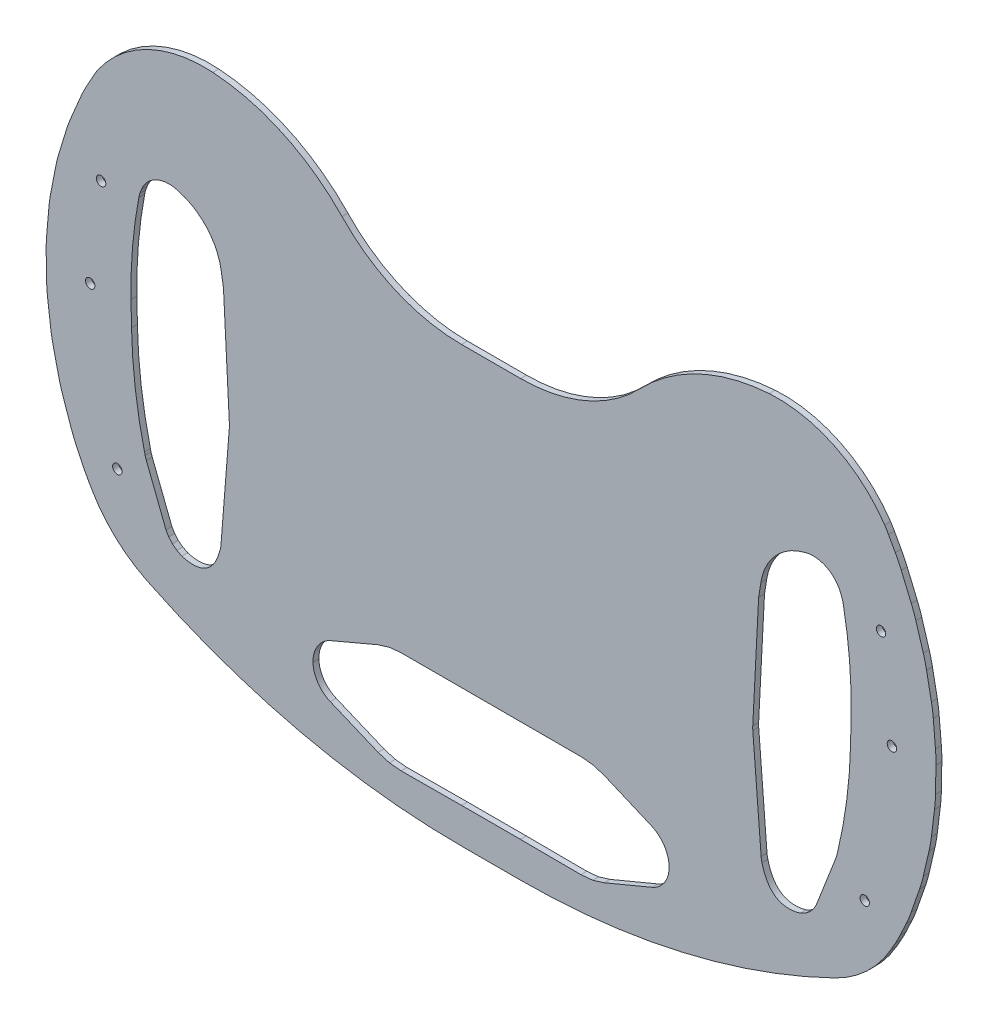
from build123d import *

# Parameters (mm, degrees)
SKETCH1_R           = 1.600004733
SKETCH1_R_2         = 1.600008458
SKETCH1_R_3         = 1.600001007
BOSS_EXTRUDE1_DEPTH = 2


with BuildPart() as part:
    # Sketch1 → Boss-Extrude1 (new body)
    with BuildSketch(Plane(origin=(0, 0, 3.49999997), x_dir=(-1, 0, 0), z_dir=(0, 0, -1))):
        with BuildLine():
            Line((-20, -102.64135196), (0, -102.64135196))
            ThreePointArc((0, -102.64135196), (54.826762958, -96.402803145), (106.850367414, -78.006118468))
            ThreePointArc((106.850367414, -78.006118468), (117.721514816, -70.507303457), (125.877694674, -60.120253705))
            Line((125.877694674, -60.120253705), (127.430048958, -57.377443185))
            ThreePointArc((127.430048958, -57.377443185), (128.246970558, -55.865942841), (129.004258673, -54.323701322))
            Line((129.004258673, -54.323701322), (131.011852014, -50.025012538))
            ThreePointArc((131.011852014, -50.025012538), (131.934514731, -47.905941493), (132.744632644, -45.741345098))
            Line((132.744632644, -45.741345098), (135.592695073, -37.476432501))
            ThreePointArc((135.592695073, -37.476432501), (136.284091675, -35.286016159), (136.86023823, -33.062503586))
            Line((136.86023823, -33.062503586), (138.815821901, -24.612835894))
            ThreePointArc((138.815821901, -24.612835894), (139.275226116, -22.361847038), (139.61651234, -20.089947662))
            Line((139.61651234, -20.089947662), (140.680309789, -11.484569813))
            ThreePointArc((140.680309789, -11.484569813), (140.902861597, -9.193521368), (141.005295113, -6.893969312))
            Line((141.005295113, -6.893969312), (141.164836348, 1.796846962))
            ThreePointArc((141.164836348, 1.796846962), (141.146870605, 4.098627751), (141.008553463, 6.396319188))
            Line((141.008553463, 6.396319188), (140.259460965, 15.056256593))
            ThreePointArc((140.259460965, 15.056256593), (140.001172695, 17.343557944), (139.62361976, 19.614221742))
            Line((139.62361976, 19.614221742), (137.974097204, 28.14852801))
            ThreePointArc((137.974097204, 28.14852801), (137.478304699, 30.396372901), (136.865634255, 32.61521309))
            Line((136.865634255, 32.61521309), (134.347453197, 40.885413673))
            ThreePointArc((134.347453197, 40.885413673), (133.622933873, 43.059929206), (132.786161536, 45.193765683))
            Line((132.786161536, 45.193765683), (129.38103378, 53.252929979))
            ThreePointArc((129.38103378, 53.252929979), (128.425728272, 55.357904754), (127.361191228, 57.40980346))
            Line((127.361191228, 57.40980346), (125.064933981, 61.565045915))
            ThreePointArc((125.064933981, 61.565045915), (124.417848961, 62.6960994), (123.737554881, 63.807495357))
            ThreePointArc((123.737554881, 63.807495357), (106.650553606, 78.494623558), (84.533580324, 82.797743379))
            ThreePointArc((84.533580324, 82.797743379), (60.673509561, 76.661567164), (40.645738515, 62.314301841))
            ThreePointArc((40.645738515, 62.314301841), (22.112560671, 49.500314192), (0.037401719, 44.987630099))
            Line((0.037401719, 44.987630099), (-20.037401719, 44.987630099))
            ThreePointArc((-20.037401719, 44.987630099), (-42.112560671, 49.500314192), (-60.645738515, 62.314301841))
            ThreePointArc((-60.645738515, 62.314301841), (-80.673509561, 76.661567164), (-104.533580324, 82.797743379))
            ThreePointArc((-104.533580324, 82.797743379), (-126.650553606, 78.494623558), (-143.737554881, 63.807495357))
            ThreePointArc((-143.737554881, 63.807495357), (-144.417848961, 62.6960994), (-145.064933981, 61.565045915))
            Line((-145.064933981, 61.565045915), (-147.361191228, 57.40980346))
            ThreePointArc((-147.361191228, 57.40980346), (-148.425728272, 55.357904754), (-149.38103378, 53.252929979))
            Line((-149.38103378, 53.252929979), (-152.786161536, 45.193765683))
            ThreePointArc((-152.786161536, 45.193765683), (-153.622933873, 43.059929206), (-154.347453197, 40.885413673))
            Line((-154.347453197, 40.885413673), (-156.865634255, 32.61521309))
            ThreePointArc((-156.865634255, 32.61521309), (-157.478304699, 30.396372901), (-157.974097204, 28.14852801))
            Line((-157.974097204, 28.14852801), (-159.62361976, 19.614221742))
            ThreePointArc((-159.62361976, 19.614221742), (-160.001172695, 17.343557944), (-160.259460965, 15.056256593))
            Line((-160.259460965, 15.056256593), (-161.008553463, 6.396319188))
            ThreePointArc((-161.008553463, 6.396319188), (-161.146870605, 4.098627751), (-161.164836348, 1.796846962))
            Line((-161.164836348, 1.796846962), (-161.005295113, -6.893969312))
            ThreePointArc((-161.005295113, -6.893969312), (-160.902861597, -9.193521368), (-160.680309789, -11.484569813))
            Line((-160.680309789, -11.484569813), (-159.61651234, -20.089947662))
            ThreePointArc((-159.61651234, -20.089947662), (-159.275226116, -22.361847038), (-158.815821901, -24.612835894))
            Line((-158.815821901, -24.612835894), (-156.86023823, -33.062503586))
            ThreePointArc((-156.86023823, -33.062503586), (-156.284091675, -35.286016159), (-155.592695073, -37.476432501))
            Line((-155.592695073, -37.476432501), (-152.744632644, -45.741345098))
            ThreePointArc((-152.744632644, -45.741345098), (-151.934514731, -47.905941493), (-151.011852014, -50.025012538))
            Line((-151.011852014, -50.025012538), (-149.004258673, -54.323701322))
            ThreePointArc((-149.004258673, -54.323701322), (-148.246970558, -55.865942841), (-147.430048958, -57.377443185))
            Line((-147.430048958, -57.377443185), (-145.877694674, -60.120253705))
            ThreePointArc((-145.877694674, -60.120253705), (-137.721514816, -70.507303457), (-126.850367414, -78.006118468))
            ThreePointArc((-126.850367414, -78.006118468), (-74.826762958, -96.402803145), (-20, -102.64135196))
        make_face()
        with Locations(Location((122.507877648, 31.873617321, 0), (0, 0, 180))):
            Circle(SKETCH1_R, mode=Mode.SUBTRACT)
        with Locations(Location((126.213986427, -0.126386527, 0), (0, 0, 180))):
            Circle(SKETCH1_R_2, mode=Mode.SUBTRACT)
        with Locations(Location((116.981077939, -50.126478076, 0), (0, 0, 180))):
            Circle(SKETCH1_R_3, mode=Mode.SUBTRACT)
        with Locations(Location((-142.507877648, 31.873617321, 0), (0, 0, 180))):
            Circle(SKETCH1_R, mode=Mode.SUBTRACT)
        with Locations(Location((-146.213986427, -0.126386527, 0), (0, 0, 180))):
            Circle(SKETCH1_R_2, mode=Mode.SUBTRACT)
        with Locations(Location((-136.981077939, -50.126478076, 0), (0, 0, 180))):
            Circle(SKETCH1_R_3, mode=Mode.SUBTRACT)
        with BuildLine():
            Line((44.633883222, -82.421982799), (28.371804087, -89.214366231))
            Line((28.371804087, -89.214366231), (24.538045485, -90.380866648))
            Line((24.538045485, -90.380866648), (20.547800836, -90.759357429))
            Line((20.547800836, -90.759357429), (0, -90.64135196))
            Line((0, -90.64135196), (-20, -90.64135196))
            Line((-20, -90.64135196), (-40.547800836, -90.759357429))
            Line((-40.547800836, -90.759357429), (-44.538045485, -90.380866648))
            Line((-44.538045485, -90.380866648), (-48.371804087, -89.214366231))
            Line((-48.371804087, -89.214366231), (-64.633883222, -82.421982799))
            ThreePointArc((-64.633883222, -82.421982799), (-68.851665981, -78.977873736), (-70.501508826, -73.788500245))
            ThreePointArc((-70.501508826, -73.788500245), (-70.501961618, -73.763472393), (-70.502383085, -73.738443994))
            ThreePointArc((-70.502383085, -73.738443994), (-68.886948973, -68.124624354), (-64.410763876, -64.371177232))
            Line((-64.410763876, -64.371177232), (-48.462577611, -57.602073997))
            Line((-48.462577611, -57.602073997), (-44.6355813, -56.413576007))
            Line((-44.6355813, -56.413576007), (-40.647576079, -56.012175977))
            Line((-40.647576079, -56.012175977), (20.647576079, -56.012175977))
            Line((20.647576079, -56.012175977), (24.6355813, -56.413576007))
            Line((24.6355813, -56.413576007), (28.462577611, -57.602073997))
            Line((28.462577611, -57.602073997), (44.410763876, -64.371177232))
            ThreePointArc((44.410763876, -64.371177232), (48.886948973, -68.124624354), (50.502383085, -73.738443994))
            ThreePointArc((50.502383085, -73.738443994), (50.501961618, -73.763472393), (50.501508826, -73.788500245))
            ThreePointArc((50.501508826, -73.788500245), (48.851665981, -78.977873736), (44.633883222, -82.421982799))
        make_face(mode=Mode.SUBTRACT)
        with BuildLine():
            Line((112.330870392, 2.008193919), (112.169496221, -6.17720884))
            ThreePointArc((112.169496221, -6.17720884), (110.892523408, -23.440775319), (107.757978426, -40.465346236))
            Line((107.757978426, -40.465346236), (107.533077653, -41.399726568))
            ThreePointArc((107.533077653, -41.399726568), (107.351568838, -42.055035972), (107.125945534, -42.696495239))
            Line((107.125945534, -42.696495239), (100.452773273, -59.788573533))
            Line((100.452773273, -59.788573533), (99.493771791, -61.407677829))
            Line((99.493771791, -61.407677829), (98.249576986, -62.818877399))
            Line((98.249576986, -62.818877399), (96.762277186, -63.972175121))
            Line((96.762277186, -63.972175121), (95.085576177, -64.825676382))
            add(Edge.make_bspline(
                [(95.085576177, -64.825676382), (88.312025213, -66.758417494), (83.965214614, -63.969601877), (82.04514438, -56.45922953)],
                knots=[0, 0, 0, 0, 1, 1, 1, 1], degree=3))
            ThreePointArc((82.04514438, -56.45922953), (81.868931385, -55.62230847), (81.764876801, -54.773391205))
            Line((81.764876801, -54.773391205), (78.93494376, -19.111380398))
            ThreePointArc((78.93494376, -19.111380398), (78.904575446, -18.459552266), (78.916783219, -17.807131298))
            Line((78.916783219, -17.807131298), (80.908394643, 20.949956745))
            Line((80.908394643, 20.949956745), (81.679197131, 25.811073766))
            ThreePointArc((81.679197131, 25.811073766), (86.570645848, 36.062773688), (96.255892095, 41.997386313))
            Line((96.255892095, 41.997386313), (96.92654592, 42.177092669))
            ThreePointArc((96.92654592, 42.177092669), (103.998645018, 41.456264112), (108.804873022, 36.218482919))
            ThreePointArc((108.804873022, 36.218482919), (109.063442875, 35.543245907), (109.305126974, 34.861782638))
            ThreePointArc((109.305126974, 34.861782638), (109.509516854, 34.186433218), (109.665774911, 33.498352204))
            Line((109.665774911, 33.498352204), (109.681650993, 33.414910346))
            ThreePointArc((109.681650993, 33.414910346), (111.822510129, 17.780404406), (112.330870392, 2.008193919))
        make_face(mode=Mode.SUBTRACT)
        with BuildLine():
            Line((-129.681650993, 33.414910346), (-129.665774911, 33.498352204))
            ThreePointArc((-129.665774911, 33.498352204), (-129.509516854, 34.186433218), (-129.305126974, 34.861782638))
            ThreePointArc((-129.305126974, 34.861782638), (-129.063442875, 35.543245907), (-128.804873022, 36.218482919))
            ThreePointArc((-128.804873022, 36.218482919), (-123.998645018, 41.456264112), (-116.92654592, 42.177092669))
            Line((-116.92654592, 42.177092669), (-116.255892095, 41.997386313))
            ThreePointArc((-116.255892095, 41.997386313), (-106.570645848, 36.062773688), (-101.679197131, 25.811073766))
            Line((-101.679197131, 25.811073766), (-100.908394643, 20.949956745))
            Line((-100.908394643, 20.949956745), (-98.916783219, -17.807131298))
            ThreePointArc((-98.916783219, -17.807131298), (-98.904575446, -18.459552266), (-98.93494376, -19.111380398))
            Line((-98.93494376, -19.111380398), (-101.764876801, -54.773391205))
            ThreePointArc((-101.764876801, -54.773391205), (-101.868931385, -55.62230847), (-102.04514438, -56.45922953))
            add(Edge.make_bspline(
                [(-115.085576177, -64.825676382), (-108.312025213, -66.758417494), (-103.965214614, -63.969601877), (-102.04514438, -56.45922953)],
                knots=[0, 0, 0, 0, 1, 1, 1, 1], degree=3))
            Line((-115.085576177, -64.825676382), (-116.762277186, -63.972175121))
            Line((-116.762277186, -63.972175121), (-118.249576986, -62.818877399))
            Line((-118.249576986, -62.818877399), (-119.493771791, -61.407677829))
            Line((-119.493771791, -61.407677829), (-120.452773273, -59.788573533))
            Line((-120.452773273, -59.788573533), (-127.125945534, -42.696495239))
            ThreePointArc((-127.125945534, -42.696495239), (-127.351568838, -42.055035972), (-127.533077653, -41.399726568))
            Line((-127.533077653, -41.399726568), (-127.757978426, -40.465346236))
            ThreePointArc((-127.757978426, -40.465346236), (-130.892523408, -23.440775319), (-132.169496221, -6.17720884))
            Line((-132.169496221, -6.17720884), (-132.330870392, 2.008193919))
            ThreePointArc((-132.330870392, 2.008193919), (-131.822510129, 17.780404406), (-129.681650993, 33.414910346))
        make_face(mode=Mode.SUBTRACT)
    extrude(amount=-BOSS_EXTRUDE1_DEPTH)


solid = part.part
